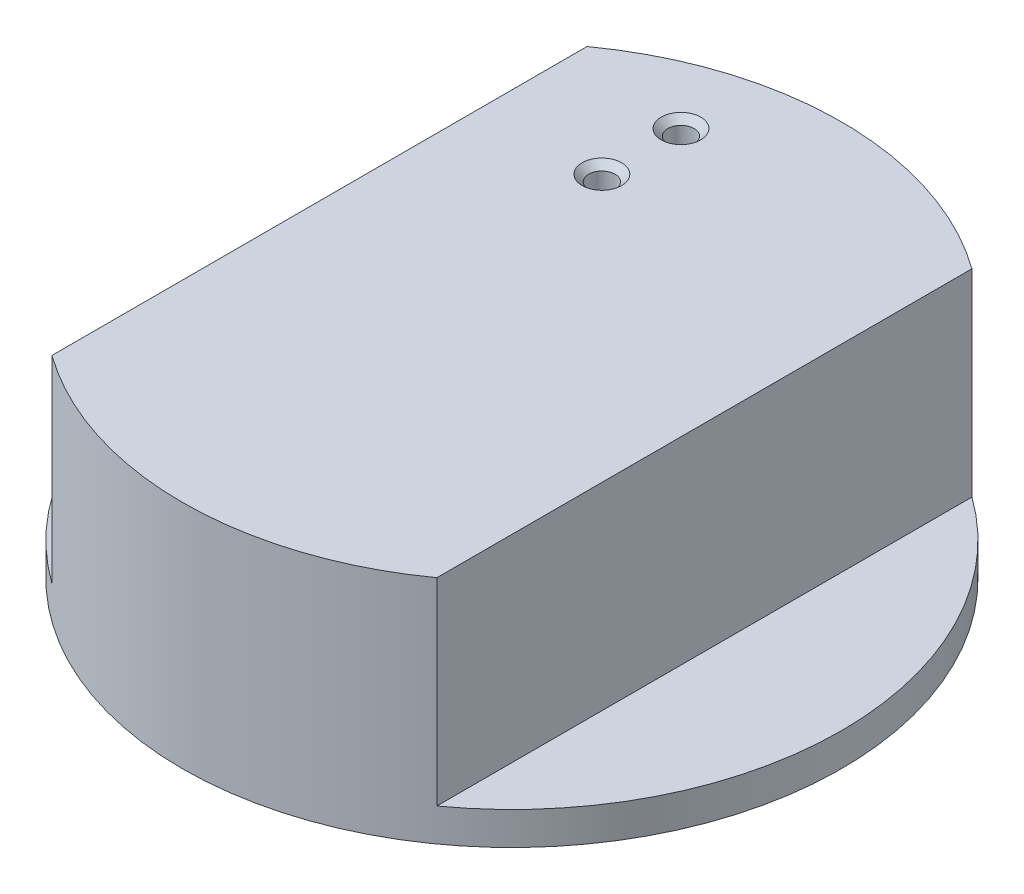
from build123d import *

# Parameters (mm, degrees)
IZIM1_R                     = 50
BASE_DEPTH                  = 5
Y_KSEKLIK_EKSTR_ZYON2_START = 30
Y_KSEKLIK_EKSTR_ZYON2_DEPTH = 30
IZIM2_R                     = 2
BANANA_SLOTU_DEPTH          = 79.89866919
PAH1_SIZE                   = 1


with BuildPart() as part:
    # Çizim1 → base (new body)
    with BuildSketch(Plane(origin=(0, 0, 0), x_dir=(1, 0, 0), z_dir=(0, 1, 0))):
        Circle(IZIM1_R)
    extrude(amount=-BASE_DEPTH)

    # Çizim1<3> → Yükseklik-Ekstrüzyon2 (add)
    with BuildSketch(Plane(origin=(0, 0, 0), x_dir=(1, 0, 0), z_dir=(0, 1, 0)).offset(Y_KSEKLIK_EKSTR_ZYON2_START)):
        with BuildLine():
            ThreePointArc((29.199046601, 40.588368748), (0, 50), (-29.199046601, 40.588368748))
            Line((-29.199046601, 40.588368748), (-29.199046601, 16.5))
            Line((-29.199046601, 16.5), (-29.199046601, -16.5))
            Line((-29.199046601, -16.5), (-29.199046601, -40.588368748))
            ThreePointArc((-29.199046601, -40.588368748), (0, -50), (29.199046601, -40.588368748))
            Line((29.199046601, -40.588368748), (29.199046601, -16.5))
            Line((29.199046601, -16.5), (29.199046601, 16.5))
            Line((29.199046601, 16.5), (29.199046601, 40.588368748))
        make_face()
    extrude(amount=-Y_KSEKLIK_EKSTR_ZYON2_DEPTH)

    # Çizim2 → banana slotu (cut, through all)
    with BuildSketch(Plane(origin=(0, 30, 0), x_dir=(1, 0, 0), z_dir=(0, 1, 0))):
        with Locations((-11.3, 36.942764929)):
            Circle(IZIM2_R)
        with Locations((-11.3, 24.942764929)):
            Circle(IZIM2_R)
    extrude(amount=-BANANA_SLOTU_DEPTH, mode=Mode.SUBTRACT)

    # Pah1
    pah1_edges = [part.edges().sort_by_distance(p)[0] for p in [
        (-13.3, 30, -36.942764929),
        (-13.3, 30, -24.942764929),
    ]]
    chamfer(pah1_edges, length=PAH1_SIZE)


solid = part.part
